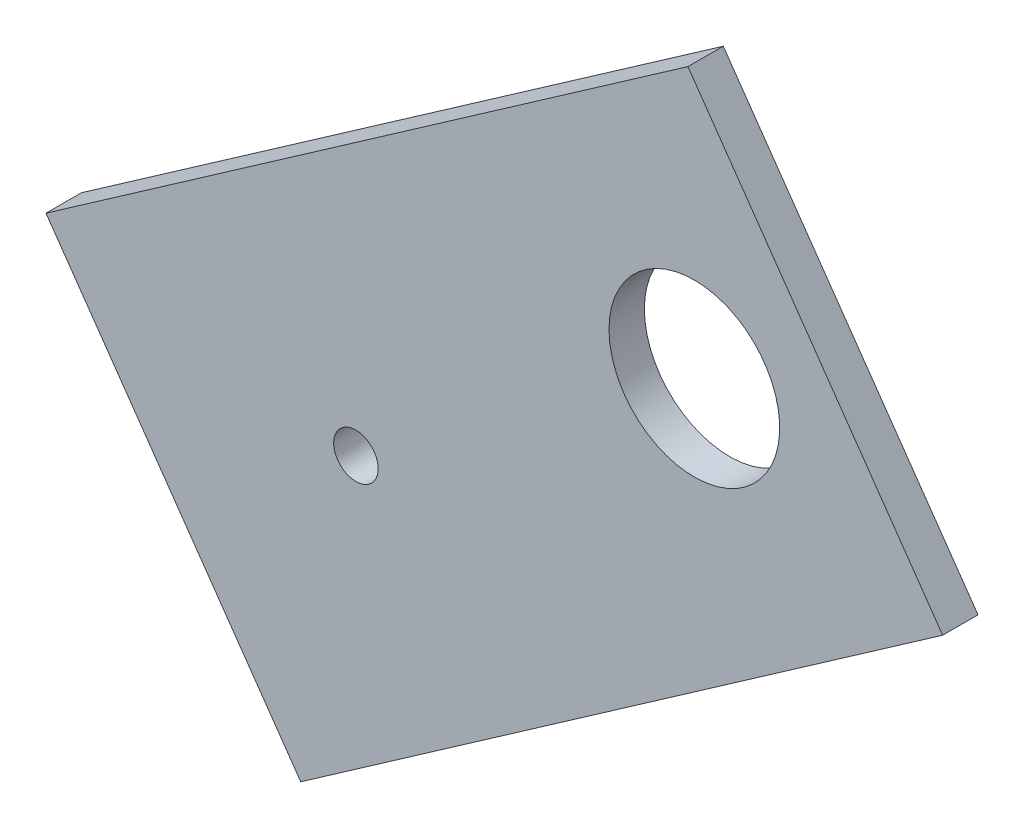
from build123d import *

# Parameters (mm, degrees)
SKETCH1_R           = 3
SKETCH1_R_2         = 11.5
BOSS_EXTRUDE1_DEPTH = 4.7625


with BuildPart() as part:
    # Sketch1 → Boss-Extrude1 (new body)
    with BuildSketch(Plane.XY):
        Polygon((21.936631743, 65.154612456), (-64.58116939, 4.790688487), (-30.249253249, -44.416216862), (56.268547885, 15.947707107), align=None)
        with Locations(Location((-22.811758645, -2.646806117, 0), (0, 0, 180))):
            Circle(SKETCH1_R, mode=Mode.SUBTRACT)
        with Locations(Location((22.800025974, 29.176775421, 0), (0, 0, 180))):
            Circle(SKETCH1_R_2, mode=Mode.SUBTRACT)
    extrude(amount=BOSS_EXTRUDE1_DEPTH)


solid = part.part
